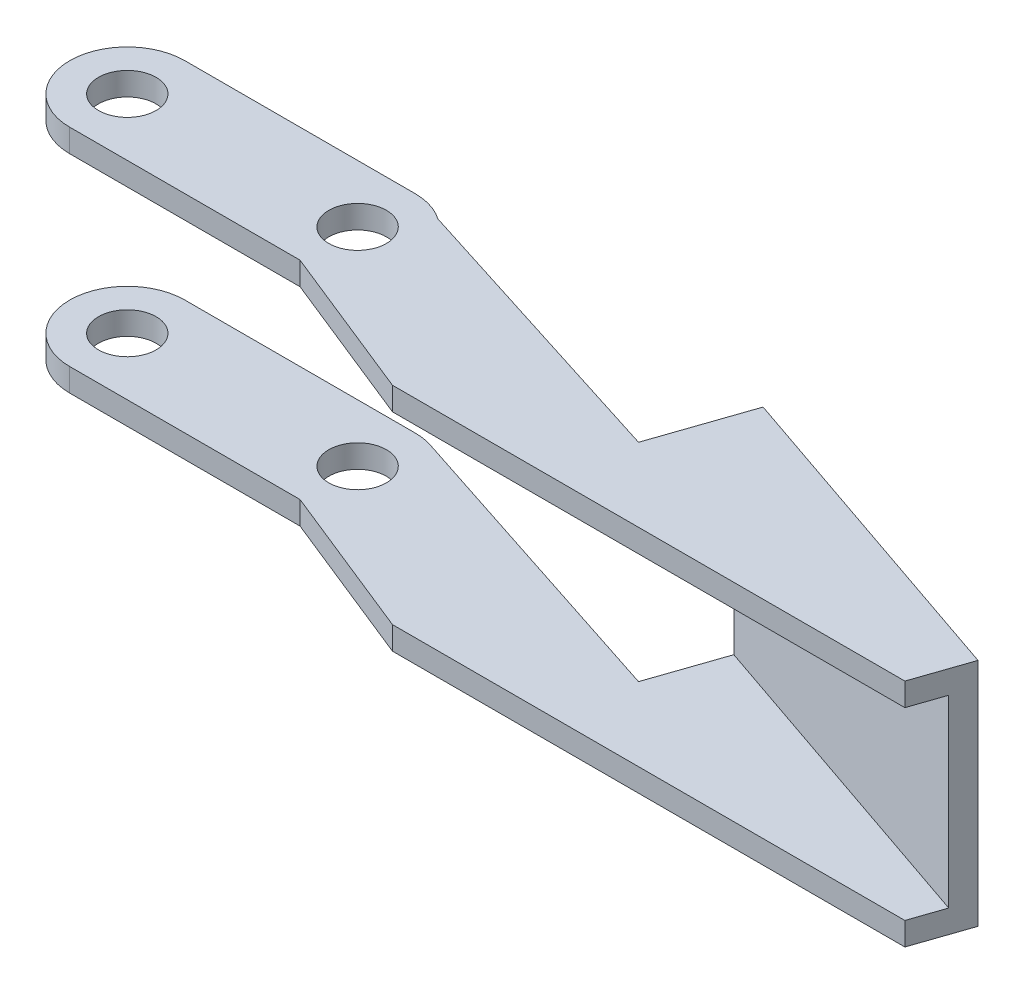
from build123d import *

# Parameters (mm, degrees)
SKETCH1_R           = 2.5
BOSS_EXTRUDE1_DEPTH = 2
BOSS_EXTRUDE2_DEPTH = 2
BOSS_EXTRUDE3_DEPTH = 16
BOSS_EXTRUDE4_START = 2
SKETCH5_R           = 2.5
BOSS_EXTRUDE4_DEPTH = 2


with BuildPart() as part:
    # Sketch1 → Boss-Extrude1 (new body)
    with BuildSketch(Plane(origin=(0, 0, 0), x_dir=(1, 0, 0), z_dir=(0, 1, 0))):
        with BuildLine():
            Line((0, 5), (20, 5))
            ThreePointArc((20, 5), (25, 0), (20, -5))
            Line((20, -5), (0, -5))
            ThreePointArc((0, -5), (-5, 0), (0, 5))
        make_face()
        with Locations(Location((0, 0, 0), (0, 0, 270))):
            Circle(SKETCH1_R, mode=Mode.SUBTRACT)
        with Locations(Location((20, 0, 0), (0, 0, 270))):
            Circle(SKETCH1_R, mode=Mode.SUBTRACT)
    extrude(amount=BOSS_EXTRUDE1_DEPTH)

    # Sketch3 → Boss-Extrude2 (add)
    with BuildSketch(Plane(origin=(0, 2, 0), x_dir=(1, 0, 0), z_dir=(0, 1, 0))):
        Polygon((20, 5), (48.392339972, -4.000005434), (51.150724408, 4.055463463), (79.532873786, -5.663260562), (77.913086448, -10.393618791), (33.419519193, -10.393618791), (20, -5), (24.317409575, 2.521898999), align=None)
    extrude(amount=-BOSS_EXTRUDE2_DEPTH)

    # Sketch4 → Boss-Extrude3 (add)
    with BuildSketch(Plane.XZ):
        Polygon((51.150724408, -4.055463463), (79.532873786, 5.663260562), (78.884958851, 7.555403854), (50.502809473, -2.163320171), align=None)
    extrude(amount=BOSS_EXTRUDE3_DEPTH)

    # Sketch5 → Boss-Extrude4 (add)
    with BuildSketch(Plane.XZ.offset(16).offset(BOSS_EXTRUDE4_START)):
        with BuildLine():
            Line((48.392339972, 4.000005434), (51.150724408, -4.055463463))
            Line((51.150724408, -4.055463463), (79.532873786, 5.663260562))
            Line((79.532873786, 5.663260562), (77.913086448, 10.393618791))
            Line((77.913086448, 10.393618791), (33.419519193, 10.393618791))
            Line((33.419519193, 10.393618791), (20, 5))
            Line((20, 5), (0, 5))
            ThreePointArc((0, 5), (-5, 0), (0, -5))
            Line((0, -5), (20, -5))
            ThreePointArc((20, -5), (20.764409298, -4.941222361), (21.510846527, -4.76627137))
            Line((21.510846527, -4.76627137), (21.589436532, -4.740642521))
            Line((21.589436532, -4.740642521), (48.392339972, 4.000005434))
        make_face()
        with Locations(Location((0, 0, 0), (0, 0, 90))):
            Circle(SKETCH5_R, mode=Mode.SUBTRACT)
        with Locations(Location((20, 0, 0), (0, 0, 270))):
            Circle(SKETCH5_R, mode=Mode.SUBTRACT)
    extrude(amount=-BOSS_EXTRUDE4_DEPTH)


solid = part.part
